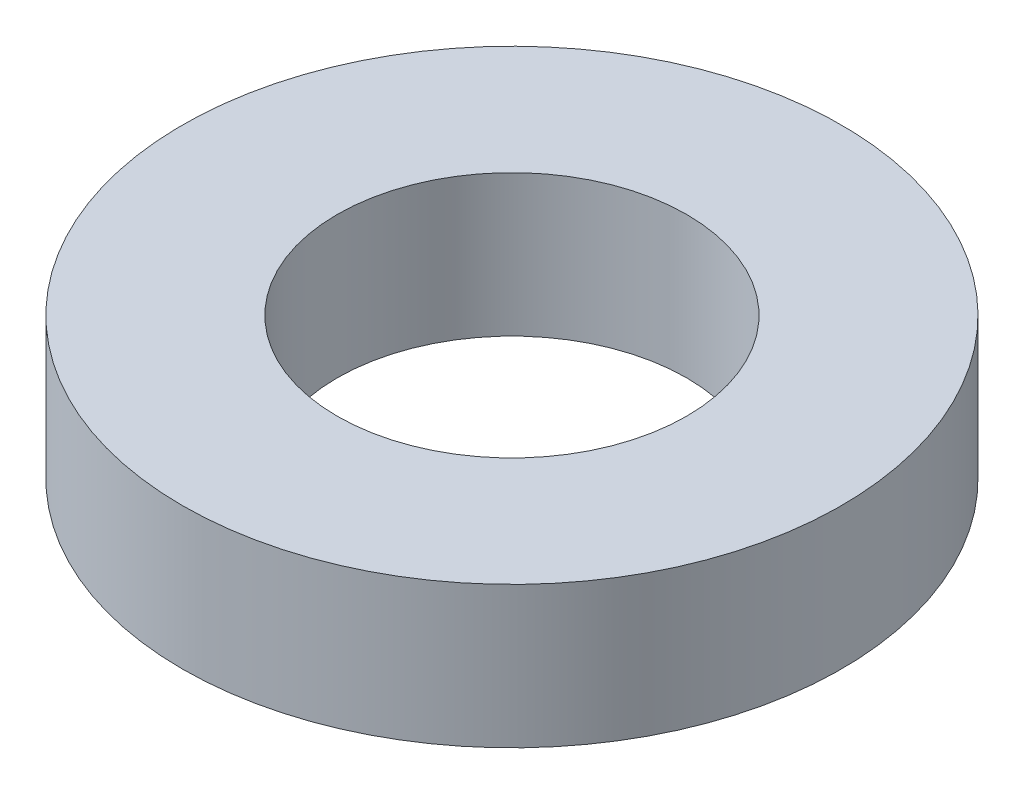
from build123d import *

# Parameters (mm, degrees)
SKETCH1_R           = 1.8923
SKETCH1_R_2         = 1.0033
BOSS_EXTRUDE1_DEPTH = 0.8128


with BuildPart() as part:
    # Sketch1 → Boss-Extrude1 (new body)
    with BuildSketch(Plane(origin=(0, 0, 0), x_dir=(1, 0, 0), z_dir=(0, 1, 0))):
        with Locations(Location((0, -2.058748448, 0), (0, 0, 270))):
            Circle(SKETCH1_R)
        with Locations(Location((0, -2.058748448, 0), (0, 0, 270))):
            Circle(SKETCH1_R_2, mode=Mode.SUBTRACT)
    extrude(amount=BOSS_EXTRUDE1_DEPTH)


solid = part.part
